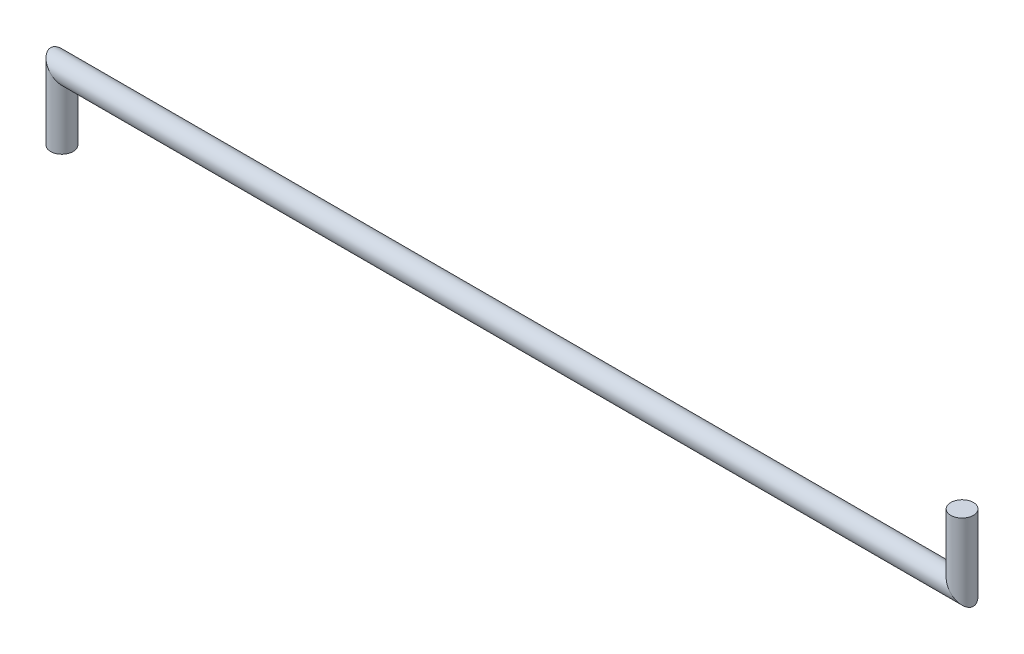
from build123d import *

# Parameters (mm, degrees)
CROQUIS2_R = 0.5


with BuildPart() as part:
    # Barrer2: sweep along a path in Croquis1
    with BuildLine(Plane.XY) as barrer2_path:
        Line((-77.081784827, 1.901408451), (-77.081784827, 4.901408451))
        Line((-77.081784827, 4.901408451), (-37.081784827, 4.901408451))
        Line((-37.081784827, 4.901408451), (-37.081784827, 7.901408451))
    # Croquis2 → Barrer2 (sweep)
    with BuildSketch(Plane(origin=(0, 7.901408451, 0), x_dir=(1, 0, 0), z_dir=(0, 1, 0))):
        with Locations((-37.081784827, 0)):
            Circle(CROQUIS2_R)
    sweep(path=barrer2_path.line, transition=Transition.RIGHT)


solid = part.part
